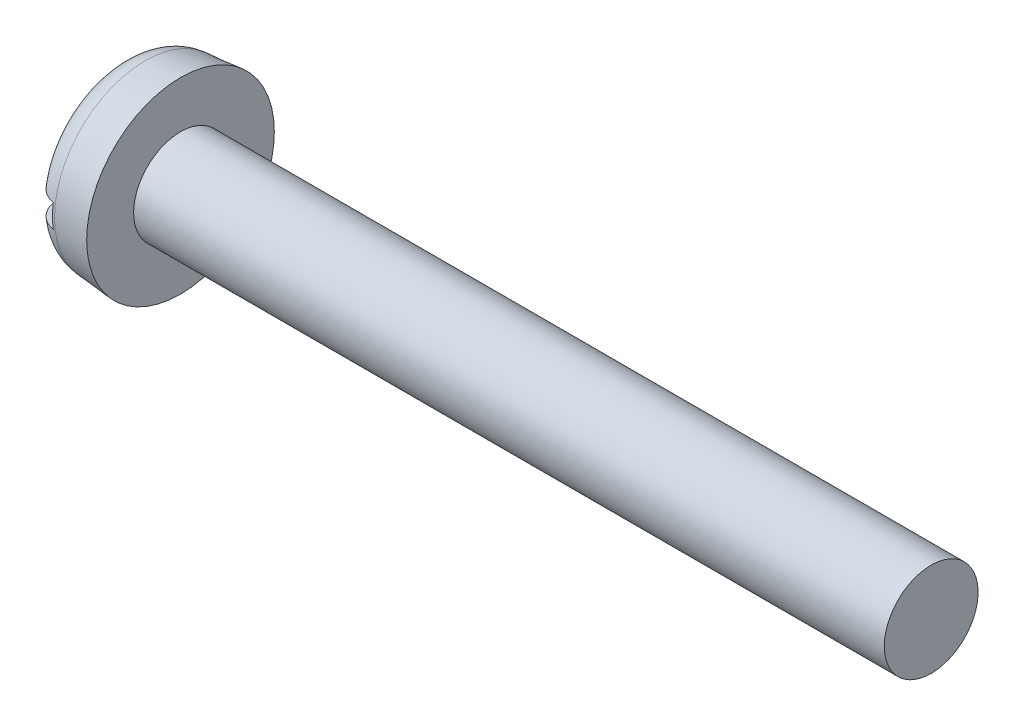
from build123d import *

# Parameters (mm, degrees)
FILLET2_R  = 0.6
SKETCH2_W  = 4
SKETCH2_H  = 0.5
SLOT_DEPTH = 0.5


with BuildPart() as part:
    # BodySke → Base-Revolve (revolve)
    with BuildSketch(Plane.XY, mode=Mode.PRIVATE) as base_revolve_sk:
        Polygon((1.3, 1), (1.3, 2), (0, 1.886264737), (0, 0), (17.3, 0), (17.3, 1), align=None)
    revolve(base_revolve_sk.sketch.rotate(Axis((-25.4, 0, 0), (1, 0, 0)), 90), axis=Axis((-25.4, 0, 0), (1, 0, 0)))

    # Fillet2
    fillet2_edges = [part.edges().sort_by_distance(p)[0] for p in [
        (0, 0, -1.886264737),
    ]]
    fillet(fillet2_edges, radius=FILLET2_R)

    # Sketch2 → Slot (cut)
    with BuildSketch(Plane(origin=(0, 0, 0), x_dir=(0, 0, -1), z_dir=(1, 0, 0))):
        Rectangle(SKETCH2_W, SKETCH2_H)
    extrude(amount=SLOT_DEPTH, mode=Mode.SUBTRACT)


solid = part.part
